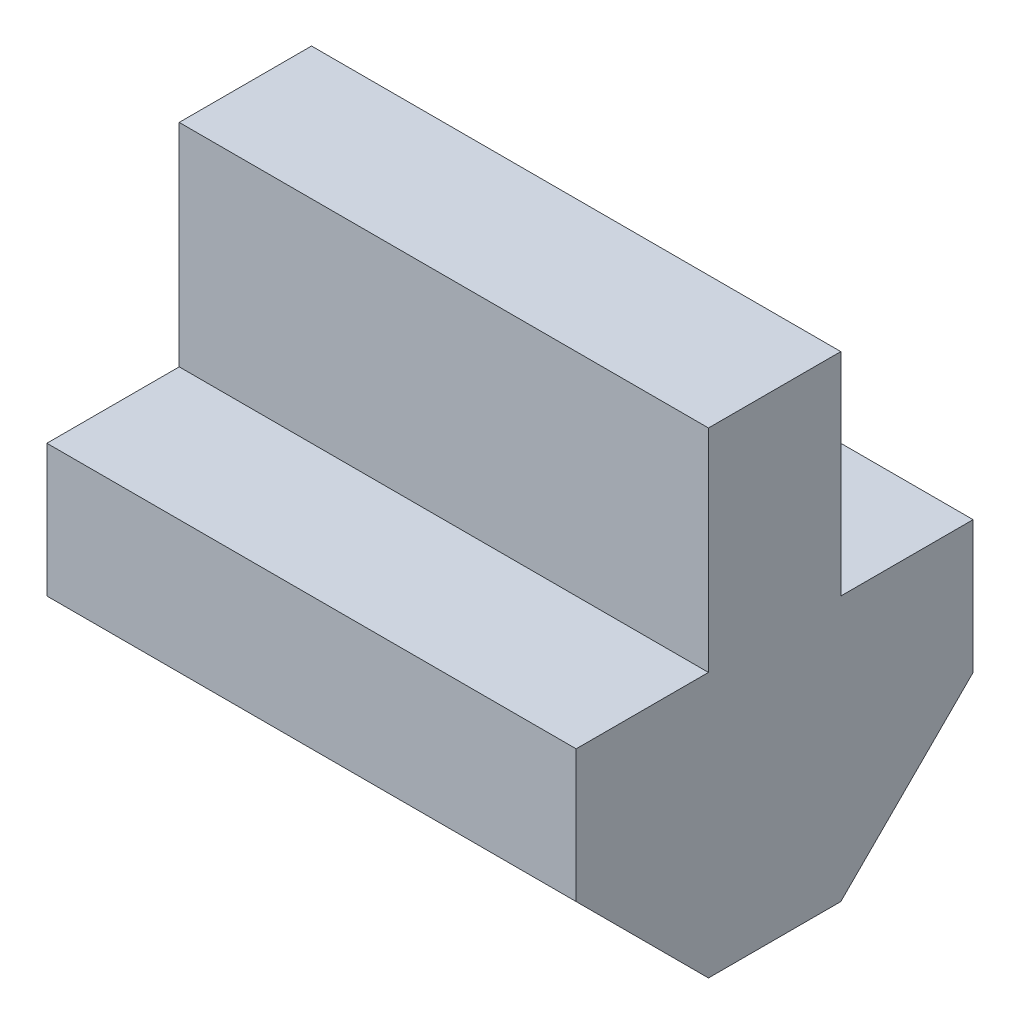
from build123d import *

# Parameters (mm, degrees)
SZKIC1_W                    = 4
SZKIC1_H                    = 3
DODANIE_WYCI_GNI_CIE1_DEPTH = 2
SZKIC3_W                    = 4
SZKIC3_H                    = 1
DODANIE_WYCI_GNI_CIE2_DEPTH = 1.6
SFAZOWANIE1_SIZE            = 1
SFAZOWANIE2_SIZE            = 1


with BuildPart() as part:
    # Szkic1 → Dodanie-wyciągnięcie1 (new body)
    with BuildSketch(Plane(origin=(0, 0, 0), x_dir=(1, 0, 0), z_dir=(0, 1, 0))):
        Rectangle(SZKIC1_W, SZKIC1_H)
    extrude(amount=DODANIE_WYCI_GNI_CIE1_DEPTH)

    # Szkic3 → Dodanie-wyciągnięcie2 (add)
    with BuildSketch(Plane(origin=(0, 2, 0), x_dir=(1, 0, 0), z_dir=(0, 1, 0))):
        Rectangle(SZKIC3_W, SZKIC3_H)
    extrude(amount=DODANIE_WYCI_GNI_CIE2_DEPTH)

    # Sfazowanie1
    sfazowanie1_edges = [part.edges().sort_by_distance(p)[0] for p in [
        (0, 0, 1.5),
    ]]
    chamfer(sfazowanie1_edges, length=SFAZOWANIE1_SIZE)

    # Sfazowanie2
    sfazowanie2_edges = [part.edges().sort_by_distance(p)[0] for p in [
        (0, 0, -1.5),
    ]]
    chamfer(sfazowanie2_edges, length=SFAZOWANIE2_SIZE)


solid = part.part
